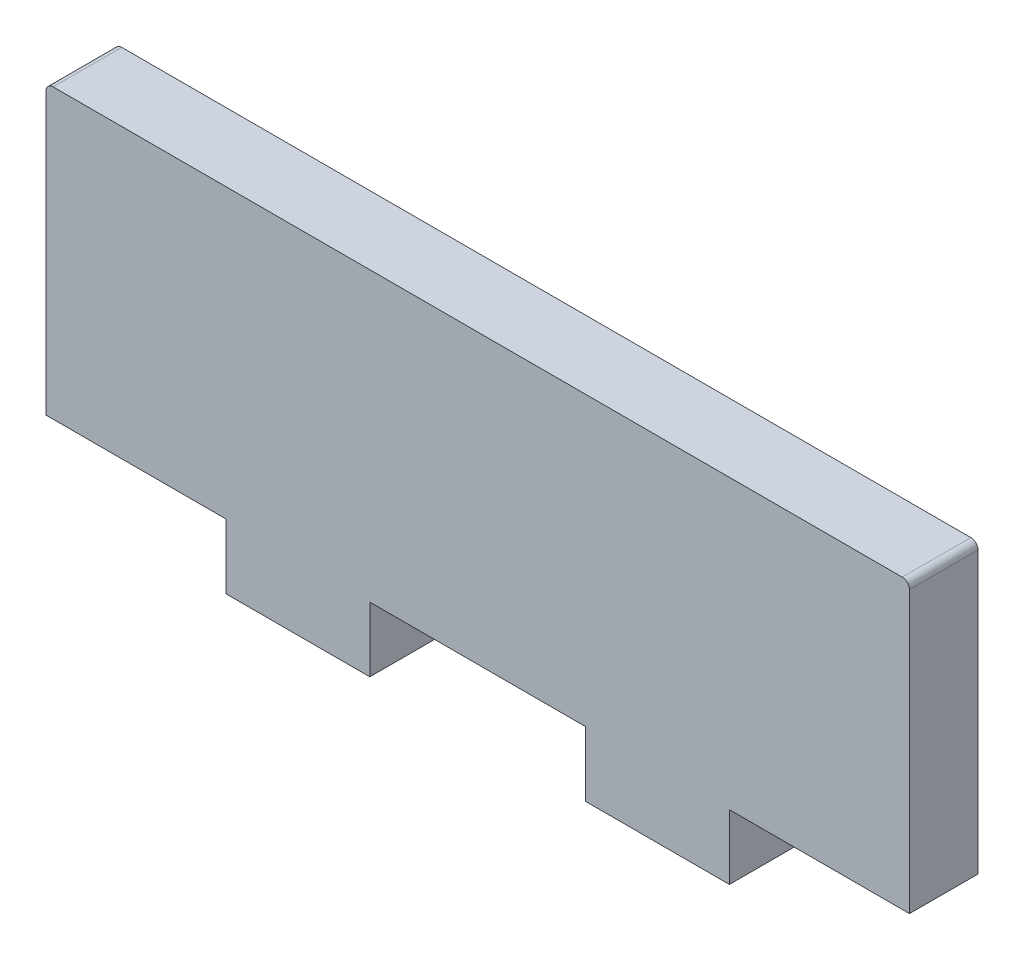
from build123d import *

# Parameters (mm, degrees)
SKETCH1_W           = 120
SKETCH1_H           = 40
SKETCH1_W_2         = 19.98
SKETCH1_H_2         = 9
BOSS_EXTRUDE1_DEPTH = 4.7625
FILLET1_R           = 1


with BuildPart() as part:
    # Sketch1 → Boss-Extrude1 (new, symmetric)
    with BuildSketch(Plane.XY):
        Rectangle(SKETCH1_W, SKETCH1_H)
        with Locations((-24.99, -24.5)):
            Rectangle(SKETCH1_W_2, SKETCH1_H_2)
        with Locations((24.99, -24.5)):
            Rectangle(SKETCH1_W_2, SKETCH1_H_2)
    extrude(amount=BOSS_EXTRUDE1_DEPTH, both=True)

    # Fillet1
    fillet1_edges = [part.edges().sort_by_distance(p)[0] for p in [
        (-60, 20, 0),
        (60, 20, 0),
    ]]
    fillet(fillet1_edges, radius=FILLET1_R)


solid = part.part
